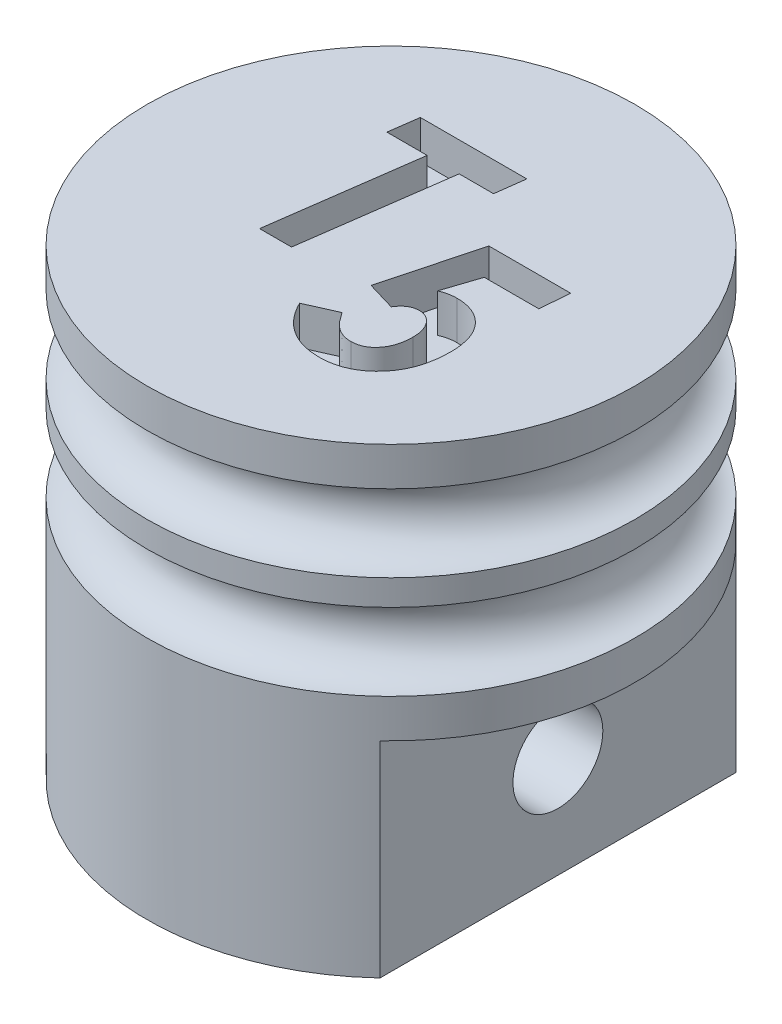
from build123d import *

# Parameters (mm, degrees)
SKETCH1_R               = 9.5
SKETCH1_R_2             = 1.75
BOSS_EXTRUDE1_DEPTH     = 18
SKETCH2_R               = 1.5
CUT_EXTRUDE1_DEPTH      = 23.461077445
CUT_EXTRUDE1_DEPTH_BACK = 23.461077445
SKETCH3_W               = 3
SKETCH3_H               = 8
SKETCH4_W               = 3
SKETCH4_H               = 6
CUT_EXTRUDE2_DEPTH      = 8
CUT_EXTRUDE3_REACH      = 27.889
SKETCH5_R               = 1.75
BOSS_EXTRUDE2_START     = -8.5
SKETCH6_R               = 1.75
BOSS_EXTRUDE2_DEPTH     = 8.5
CUT_EXTRUDE4_DEPTH      = 1.5


with BuildPart() as part:
    # Sketch1 → Boss-Extrude1 (new body)
    with BuildSketch(Plane(origin=(0, 0, 0), x_dir=(1, 0, 0), z_dir=(0, 1, 0))):
        with Locations(Location((0, 0, 0), (0, 0, 270))):
            Circle(SKETCH1_R)
        with Locations(Location((0, 0, 0), (0, 0, 270))):
            Circle(SKETCH1_R_2, mode=Mode.SUBTRACT)
    extrude(amount=BOSS_EXTRUDE1_DEPTH)

    # Sketch2 → Cut-Revolve1 (revolve, cut)
    with BuildSketch(Plane(origin=(0, 0, 0), x_dir=(0, 0, -1), z_dir=(1, 0, 0)), mode=Mode.PRIVATE) as cut_revolve1_sk:
        with Locations((-9.5, 15)):
            Circle(SKETCH2_R)
        with Locations((-9.5, 11)):
            Circle(SKETCH2_R)
    revolve(cut_revolve1_sk.sketch.rotate(Axis((0, 18, 0), (0, -1, 0)), 180), axis=Axis((0, 18, 0), (0, -1, 0)), mode=Mode.SUBTRACT)

    # Sketch3 → Cut-Extrude1 (cut, two sides: drawn at the far end of the back side and taken through both)
    with BuildSketch(Plane.XY.offset(-CUT_EXTRUDE1_DEPTH_BACK)):
        with Locations((8, 4)):
            Rectangle(SKETCH3_W, SKETCH3_H)
    extrude(amount=CUT_EXTRUDE1_DEPTH + CUT_EXTRUDE1_DEPTH_BACK, mode=Mode.SUBTRACT)

    # Sketch4 → Cut-Extrude2 (cut)
    with BuildSketch(Plane.XZ):
        with Locations((2, 0)):
            Rectangle(SKETCH4_W, SKETCH4_H)
    extrude(amount=-CUT_EXTRUDE2_DEPTH, mode=Mode.SUBTRACT)

    # Sketch5 → Cut-Extrude3 (cut, up to next)
    with BuildSketch(Plane(origin=(6.5, 0, 0), x_dir=(0, 0, -1), z_dir=(1, 0, 0)), mode=Mode.PRIVATE) as cut_extrude3_sk1:
        with Locations((0, 4)):
            Circle(SKETCH5_R)
    cut_extrude3_tool1 = extrude(cut_extrude3_sk1.sketch, amount=-CUT_EXTRUDE3_REACH, mode=Mode.PRIVATE) & part.part
    add(cut_extrude3_tool1.solids().sort_by_distance((6.5, 4, 0))[0], mode=Mode.SUBTRACT)

    # Sketch6 → Boss-Extrude2 (add)
    with BuildSketch(Plane(origin=(0, 18, 0), x_dir=(1, 0, 0), z_dir=(0, 1, 0)).offset(BOSS_EXTRUDE2_START)):
        with Locations(Location((0, 0, 0), (0, 0, 73.398450401))):
            Circle(SKETCH6_R)
    extrude(amount=BOSS_EXTRUDE2_DEPTH)

    # Sketch7 → Cut-Extrude4 (cut)
    with BuildSketch(Plane(origin=(0, 18, 0), x_dir=(1, 0, 0), z_dir=(0, 1, 0))):
        Polygon((-3.735416667, 4.879166667), (0.409722222, 4.879166667), (0.260894097, 3.732638889), (-1.078559028, 3.732638889), (-1.873687066, -2), (-3.118055556, -2), (-2.324305556, 3.732638889), (-3.893891059, 3.732638889), align=None)
        with BuildLine():
            Line((1.93063151, 1.879166667), (5.115277778, 1.879166667))
            Line((5.115277778, 1.879166667), (5.027083333, 0.732638889))
            Line((5.027083333, 0.732638889), (2.899392361, 0.732638889))
            Line((2.899392361, 0.732638889), (2.447395833, -0.634375))
            add(Edge.make_bspline(
                [(2.447395833, -0.634375), (2.496594075, -0.613896402), (2.595019861, -0.57292701), (2.749839769, -0.532892585), (2.908139813, -0.506658512), (3.015040488, -0.503615987), (3.068891059, -0.502083333)],
                knots=[0, 0, 0, 0, 0.998112439, 1.996819346, 2.990909824, 4, 4, 4, 4], degree=3))
            add(Edge.make_bspline(
                [(3.068891059, -0.502083333), (3.130977849, -0.503710927), (3.252390467, -0.506893737), (3.430147714, -0.530676662), (3.598897739, -0.570188022), (3.758037558, -0.627264893), (3.908251801, -0.698872885), (4.047892395, -0.787903157), (4.178629893, -0.892282921), (4.299407696, -1.011738133), (4.408795358, -1.145923516), (4.504121795, -1.293773987), (4.584127105, -1.455328827), (4.650907598, -1.628980167), (4.699239379, -1.817024844), (4.736887191, -2.016677617), (4.75910168, -2.230101729), (4.761345538, -2.376622611), (4.7625, -2.452007378)],
                knots=[0, 0, 0, 0, 1.020720285, 1.996049746, 2.943245614, 3.865445419, 4.770849874, 5.674014514, 6.582344456, 7.517049549, 8.461983903, 9.42367584, 10.403295435, 11.421749409, 12.477096939, 13.591170916, 14.760661157, 16, 16, 16, 16], degree=3))
            add(Edge.make_bspline(
                [(4.7625, -2.452007378), (4.760331263, -2.551305248), (4.756082769, -2.745827008), (4.724357481, -3.030366667), (4.670434408, -3.299932267), (4.596788587, -3.55576096), (4.497839346, -3.795403814), (4.381045078, -4.022055988), (4.240535383, -4.23285879), (4.079959926, -4.426863528), (3.90500901, -4.6032865), (3.715999291, -4.755276836), (3.51825895, -4.886229848), (3.309156679, -4.99341577), (3.088438962, -5.074038184), (2.858442877, -5.134443243), (2.617463381, -5.168719531), (2.453470724, -5.173806613), (2.370225694, -5.176388889)],
                knots=[0, 0, 0, 0, 1.173543811, 2.298939634, 3.378629864, 4.419763593, 5.440091566, 6.438176937, 7.429014836, 8.427971092, 9.41078854, 10.360474936, 11.289592146, 12.209863076, 13.130646371, 14.061665239, 15.016073429, 16, 16, 16, 16], degree=3))
            add(Edge.make_bspline(
                [(2.370225694, -5.176388889), (2.310933889, -5.175336104), (2.193952372, -5.173258982), (2.020726741, -5.156555087), (1.852671583, -5.127655453), (1.689527041, -5.086994539), (1.530531877, -5.038216677), (1.376964542, -4.976019014), (1.229625203, -4.900480546), (1.08541527, -4.817015387), (0.94797473, -4.720741688), (0.817898945, -4.612055658), (0.693643574, -4.493656656), (0.576265412, -4.363698122), (0.466116126, -4.222246293), (0.360964906, -4.071122574), (0.264514937, -3.907473589), (0.206115245, -3.793152274), (0.176388889, -3.734960938)],
                knots=[0, 0, 0, 0, 1.022859238, 2.018080294, 2.999190336, 3.962207893, 4.917235095, 5.866490093, 6.816373485, 7.771926692, 8.739336783, 9.707395925, 10.693964512, 11.698357727, 12.725720478, 13.785346591, 14.8727068, 16, 16, 16, 16], degree=3))
            Line((0.176388889, -3.734960938), (1.318782552, -3.225086806))
            add(Edge.make_bspline(
                [(1.318782552, -3.225086806), (1.366983822, -3.296490214), (1.457415836, -3.430452538), (1.598648511, -3.608942531), (1.738402882, -3.749836535), (1.87577747, -3.85858293), (2.016355711, -3.936444461), (2.160759687, -3.990581364), (2.311349194, -4.023320871), (2.413704476, -4.027668904), (2.46531033, -4.029861111)],
                knots=[0, 0, 0, 0, 1.407698414, 2.641030095, 3.71326683, 4.644229953, 5.494388505, 6.328183133, 7.157097367, 8, 8, 8, 8], degree=3))
            add(Edge.make_bspline(
                [(2.46531033, -4.029861111), (2.502597477, -4.028960648), (2.576241743, -4.027182182), (2.684301906, -4.008243163), (2.787874215, -3.97960222), (2.886816155, -3.939640908), (2.979376072, -3.886543817), (3.067364075, -3.822476619), (3.149686009, -3.745907333), (3.2282627, -3.660042601), (3.298101555, -3.562969472), (3.360585167, -3.458803462), (3.411342282, -3.34552927), (3.454177874, -3.225850289), (3.487464002, -3.098113353), (3.509883951, -2.962938195), (3.526380141, -2.82034566), (3.527303997, -2.722613415), (3.527777778, -2.67249349)],
                knots=[0, 0, 0, 0, 0.927075282, 1.831027126, 2.721359743, 3.598085148, 4.478603181, 5.370329063, 6.300781167, 7.271983059, 8.262041119, 9.271703604, 10.289679922, 11.345465186, 12.432354444, 13.569366541, 14.753500788, 16, 16, 16, 16], degree=3))
            add(Edge.make_bspline(
                [(3.527777778, -2.67249349), (3.525364071, -2.599249545), (3.520736664, -2.45883084), (3.479231749, -2.258812343), (3.4090829, -2.080955219), (3.310983371, -1.92926026), (3.194562907, -1.805997587), (3.06438106, -1.714608894), (2.920185823, -1.658694036), (2.819485773, -1.652001198), (2.768478733, -1.648611111)],
                knots=[0, 0, 0, 0, 1.239981349, 2.377214621, 3.442410989, 4.461421974, 5.419299017, 6.29797895, 7.137884662, 8, 8, 8, 8], degree=3))
            add(Edge.make_bspline(
                [(2.768478733, -1.648611111), (2.733962981, -1.650076188), (2.665766285, -1.652970908), (2.565430302, -1.671769102), (2.471751626, -1.70770096), (2.381470388, -1.752665642), (2.299031841, -1.814661474), (2.221082072, -1.888742142), (2.147448466, -1.975747239), (2.105339675, -2.041728663), (2.08359375, -2.075802951)],
                knots=[0, 0, 0, 0, 0.978206346, 1.932753505, 2.875607702, 3.812696253, 4.78098368, 5.784402359, 6.855815662, 8, 8, 8, 8], degree=3))
            Line((2.08359375, -2.075802951), (0.970138889, -1.745073785))
            Line((0.970138889, -1.745073785), (1.93063151, 1.879166667))
        make_face()
    extrude(amount=-CUT_EXTRUDE4_DEPTH, mode=Mode.SUBTRACT)


solid = part.part
